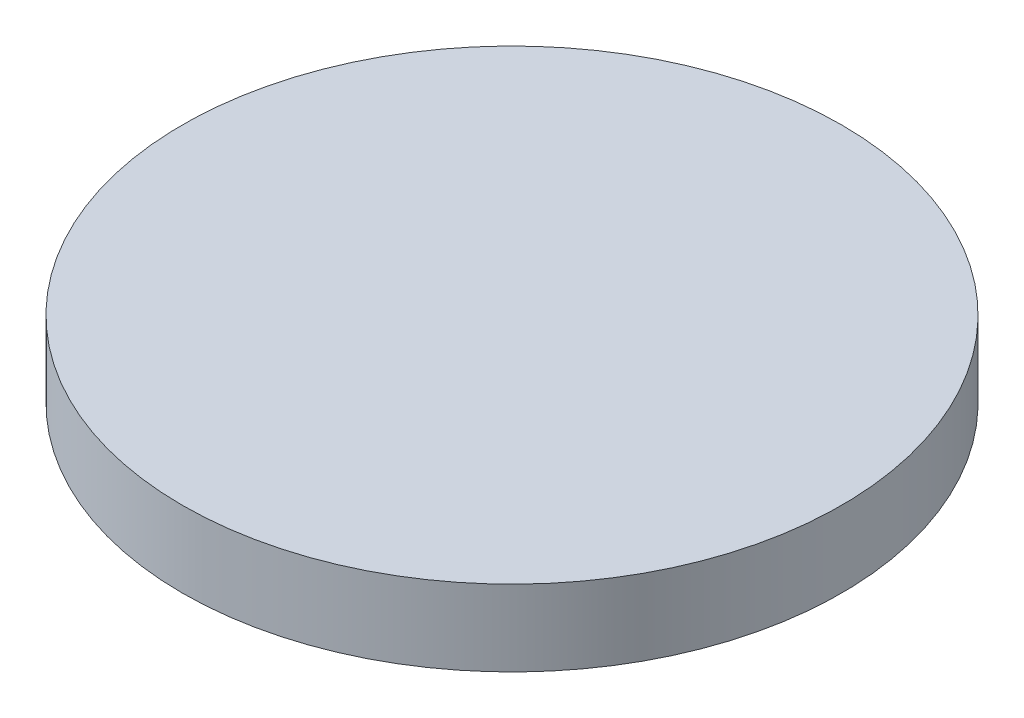
from build123d import *

# Parameters (mm, degrees)
SKETCH_1_R      = 130
EXTRUDE_1_DEPTH = 30


with BuildPart() as part:
    # Эскиз1 → Бобышка-Вытянуть1 (new body)
    with BuildSketch(Plane(origin=(0, 0, 0), x_dir=(1, 0, 0), z_dir=(0, 1, 0))):
        with Locations(Location((0, 0, 0), (0, 0, 270))):
            Circle(SKETCH_1_R)
    extrude(amount=EXTRUDE_1_DEPTH)


solid = part.part
